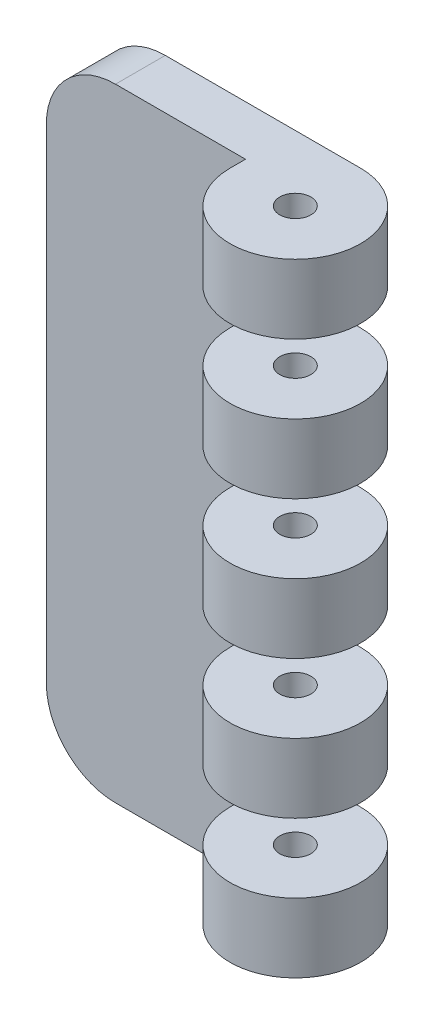
from build123d import *

# Parameters (mm, degrees)
BOSS_EXTRUDE1_START = 31.75
SKETCH3_R           = 1.5875
BOSS_EXTRUDE1_DEPTH = 63.5
FILLET1_R           = 7.055555556
SKETCH5_W           = 16.383
SKETCH5_H           = 7.055555556
CUT_EXTRUDE1_DEPTH  = 43.200038063
LPATTERN1_COUNT     = 5
LPATTERN1_PITCH     = 14.111111111
FILLET2_R           = 1.175925926
SKETCH6_W           = 16.383
SKETCH6_H           = 7.055555555
CUT_EXTRUDE2_DEPTH  = 43.200038063
LPATTERN2_COUNT     = 4
LPATTERN2_PITCH     = 14.111111111
FILLET3_R           = 1.175925926
FILLET4_R           = 0.391975309
BOSS_EXTRUDE3_START = 31.75
SKETCH7_R           = 1.5875
BOSS_EXTRUDE3_DEPTH = 63.5


with BuildPart() as part:
    # Sketch3 → Boss-Extrude1 (new body)
    with BuildSketch(Plane(origin=(0, 0, 0), x_dir=(1, 0, 0), z_dir=(0, 1, 0)).offset(BOSS_EXTRUDE1_START)):
        with BuildLine():
            Line((26.9875, 6.6675), (26.9875, 1.5875))
            Line((26.9875, 1.5875), (6.6675, 1.5875))
            Line((6.6675, 1.5875), (6.6675, 0))
            ThreePointArc((6.6675, 0), (-4.714634464, -4.714634464), (0, 6.6675))
            Line((0, 6.6675), (26.9875, 6.6675))
        make_face()
        with Locations(Location((0, 0, 0), (0, 0, 270))):
            Circle(SKETCH3_R, mode=Mode.SUBTRACT)
    extrude(amount=-BOSS_EXTRUDE1_DEPTH)

    # Fillet1
    fillet1_edges = [part.edges().sort_by_distance(p)[0] for p in [
        (26.9875, -31.75, -4.1275),
        (26.9875, 31.75, -4.1275),
    ]]
    fillet(fillet1_edges, radius=FILLET1_R)


with BuildPart() as body_2:
    # Mirror1: mirrored copy
    add(part.part.mirror(Plane(origin=(0, 0, 0), x_dir=(0, 0, 1), z_dir=(1, 0, 0))))

    # Sketch6 → Cut-Extrude2 (cut, symmetric)
    with BuildSketch(Plane.XY):
        with Locations((0, 21.166666666)):
            Rectangle(SKETCH6_W, SKETCH6_H)
    cut_extrude2 = extrude(amount=CUT_EXTRUDE2_DEPTH, both=True, mode=Mode.SUBTRACT)

    # LPattern2: Cut-Extrude2 ×4
    with Locations(*[(0, -i * LPATTERN2_PITCH, 0) for i in range(1, LPATTERN2_COUNT)]):
        add(cut_extrude2, mode=Mode.SUBTRACT)

    # Fillet3
    fillet3_edges = [body_2.edges().sort_by_distance(p)[0] for p in [
        (-8.1915, 10.583333333, -4.1275),
        (-8.1915, 3.527777778, -4.1275),
        (-8.1915, -3.527777778, -4.1275),
        (-8.1915, -10.583333333, -4.1275),
        (-8.1915, -17.638888889, -4.1275),
        (-8.1915, -24.694444444, -4.1275),
        (-8.1915, 24.694444444, -4.1275),
        (-8.1915, 17.638888889, -4.1275),
    ]]
    fillet(fillet3_edges, radius=FILLET3_R)


with BuildPart() as part_1:
    add(part.part)

    # Sketch5 → Cut-Extrude1 (cut, symmetric)
    with BuildSketch(Plane.XY):
        with Locations((0, 28.222222222)):
            Rectangle(SKETCH5_W, SKETCH5_H)
    cut_extrude1 = extrude(amount=CUT_EXTRUDE1_DEPTH, both=True, mode=Mode.SUBTRACT)

    # LPattern1: Cut-Extrude1 ×5
    with Locations(*[(0, -i * LPATTERN1_PITCH, 0) for i in range(1, LPATTERN1_COUNT)]):
        add(cut_extrude1, mode=Mode.SUBTRACT)

    # Fillet2
    fillet2_edges = [part_1.edges().sort_by_distance(p)[0] for p in [
        (8.1915, -3.527777778, -4.1275),
        (8.1915, 3.527777778, -4.1275),
        (8.1915, -17.638888889, -4.1275),
        (8.1915, -10.583333333, -4.1275),
        (8.1915, -24.694444444, -4.1275),
        (8.1915, 24.694444444, -4.1275),
        (8.1915, 10.583333333, -4.1275),
        (8.1915, 17.638888889, -4.1275),
    ]]
    fillet(fillet2_edges, radius=FILLET2_R)

    # Fillet4
    fillet4_edges = [part_1.edges().sort_by_distance(p)[0] for p in [
        (8.1915, -31.75, -4.1275),
        (8.1915, 31.75, -4.1275),
    ]]
    fillet(fillet4_edges, radius=FILLET4_R)


with BuildPart() as body_3:
    # Sketch7 → Boss-Extrude3 (new body)
    with BuildSketch(Plane(origin=(0, 0, 0), x_dir=(1, 0, 0), z_dir=(0, 1, 0)).offset(BOSS_EXTRUDE3_START)):
        with Locations(Location((0, 0, 0), (0, 0, 270))):
            Circle(SKETCH7_R)
    extrude(amount=-BOSS_EXTRUDE3_DEPTH)


solid = body_2.part
